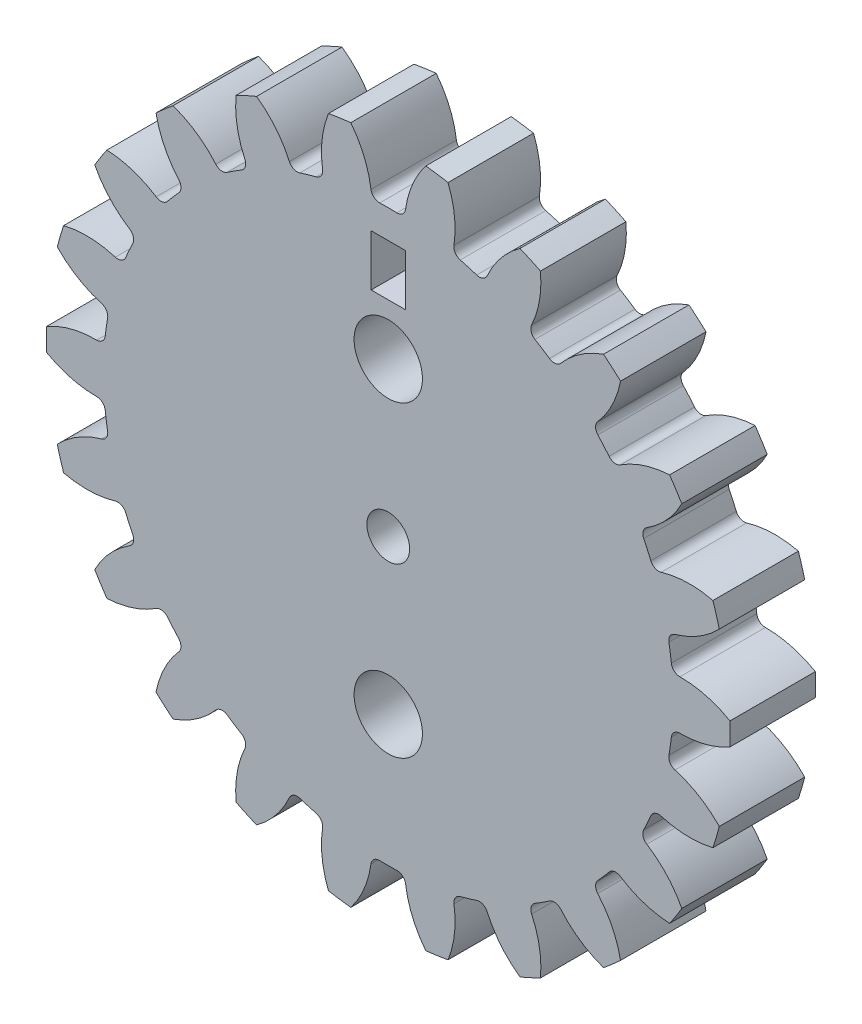
from build123d import *

# Parameters (mm, degrees)
SKETCH1_R                   = 20
BOSS_EXTRUDE1_DEPTH         = 2.5
CUT_EXTRUDE1_DEPTH          = 29.394541729
FILLET2_R                   = 0.5
CIRPATTERN1_COUNT           = 22
FILLET2_OF_CIRPATTERN1_R    = 0.5
STRING_HOLE_DEPTH           = 29.309812613
STRING_HOLE_DEPTH_BACK      = 29.309812613
SKETCH4_R                   = 1.25
TO_KNUCKLE_MOUNT_DEPTH      = 29.309812613
TO_KNUCKLE_MOUNT_DEPTH_BACK = 29.309812613
SKETCH5_R                   = 2
SKETCH7_W                   = 2
SKETCH7_H                   = 3
FOR_ALIGNMENT_DEPTH         = 2


with BuildPart() as part:
    # Sketch1 → Boss-Extrude1 (new, symmetric)
    with BuildSketch(Plane.XY):
        Circle(SKETCH1_R)
    extrude(amount=BOSS_EXTRUDE1_DEPTH, both=True)

    # Sketch3 → Cut-Extrude1 (cut, symmetric)
    with BuildSketch(Plane.XY):
        with BuildLine():
            ThreePointArc((-0.967659311, 16.638552017), (0, 16.666666667), (0.967659311, 16.638552017))
            ThreePointArc((0.967659311, 16.638552017), (1.332322024, 18.352518037), (2.191921142, 19.879524182))
            ThreePointArc((2.191921142, 19.879524182), (0, 20), (-2.191921142, 19.879524182))
            ThreePointArc((-2.191921142, 19.879524182), (-1.332322024, 18.352518037), (-0.967659311, 16.638552017))
        make_face()
    cut_extrude1 = extrude(amount=CUT_EXTRUDE1_DEPTH, both=True, mode=Mode.SUBTRACT)

    # Fillet2
    fillet2_edges = [part.edges().sort_by_distance(p)[0] for p in [
        (0.967659311, 16.638552017, 0),
        (-0.967659311, 16.638552017, 0),
    ]]
    fillet(fillet2_edges, radius=FILLET2_R)

    # CirPattern1: Cut-Extrude1 ×22 about axis
    cirpattern1_axis = Axis((0, 0, 0), (0, 0, 1))
    for i in range(1, CIRPATTERN1_COUNT):
        add(cut_extrude1.rotate(cirpattern1_axis, i * 360 / CIRPATTERN1_COUNT), mode=Mode.SUBTRACT)

    # Fillet2 of CirPattern1
    fillet2_of_cirpattern1_edges = [part.edges().sort_by_distance(p)[0] for p in [
        (-3.759159492, 16.237194884, 0),
        (-5.616084112, 15.69195262, 0),
        (-8.18143355, 14.520396787, 0),
        (-9.809527178, 13.474084545, 0),
        (-11.940896518, 11.627242498, 0),
        (-13.208260692, 10.164626274, 0),
        (-14.732979066, 7.792118172, 0),
        (-15.536939477, 6.031690433, 0),
        (-16.33148327, 3.325722774, 0),
        (-16.606907827, 1.410102905, 0),
        (-16.606907827, -1.410102905, 0),
        (-16.33148327, -3.325722774, 0),
        (-15.536939477, -6.031690433, 0),
        (-14.732979066, -7.792118172, 0),
        (-13.208260692, -10.164626274, 0),
        (-11.940896518, -11.627242498, 0),
        (-9.809527178, -13.474084545, 0),
        (-8.18143355, -14.520396787, 0),
        (-5.616084112, -15.69195262, 0),
        (-3.759159492, -16.237194884, 0),
        (-0.967659311, -16.638552017, 0),
        (0.967659311, -16.638552017, 0),
        (3.759159492, -16.237194884, 0),
        (5.616084112, -15.69195262, 0),
        (8.18143355, -14.520396787, 0),
        (9.809527178, -13.474084545, 0),
        (11.940896518, -11.627242498, 0),
        (13.208260692, -10.164626274, 0),
        (14.732979066, -7.792118172, 0),
        (15.536939477, -6.031690433, 0),
        (16.33148327, -3.325722774, 0),
        (16.606907827, -1.410102905, 0),
        (16.606907827, 1.410102905, 0),
        (16.33148327, 3.325722774, 0),
        (15.536939477, 6.031690433, 0),
        (14.732979066, 7.792118172, 0),
        (13.208260692, 10.164626274, 0),
        (11.940896518, 11.627242498, 0),
        (9.809527178, 13.474084545, 0),
        (8.18143355, 14.520396787, 0),
        (5.616084112, 15.69195262, 0),
        (3.759159492, 16.237194884, 0),
    ]]
    fillet(fillet2_of_cirpattern1_edges, radius=FILLET2_OF_CIRPATTERN1_R)

    # Sketch4 → String_Hole (cut, two sides: drawn at the far end of the back side and taken through both)
    with BuildSketch(Plane.XY.offset(-STRING_HOLE_DEPTH_BACK)):
        Circle(SKETCH4_R)
    extrude(amount=STRING_HOLE_DEPTH + STRING_HOLE_DEPTH_BACK, mode=Mode.SUBTRACT)

    # Sketch5 → To_Knuckle_Mount (cut, two sides: drawn at the far end of the back side and taken through both)
    with BuildSketch(Plane.XY.offset(-TO_KNUCKLE_MOUNT_DEPTH_BACK)):
        with Locations((0, 9)):
            Circle(SKETCH5_R)
        with Locations((0, -9)):
            Circle(SKETCH5_R)
    extrude(amount=TO_KNUCKLE_MOUNT_DEPTH + TO_KNUCKLE_MOUNT_DEPTH_BACK, mode=Mode.SUBTRACT)

    # Sketch7 → For_Alignment (cut)
    with BuildSketch(Plane.XY.offset(2.5)):
        with Locations((0, 13.5)):
            Rectangle(SKETCH7_W, SKETCH7_H)
    extrude(amount=-FOR_ALIGNMENT_DEPTH, mode=Mode.SUBTRACT)


solid = part.part
